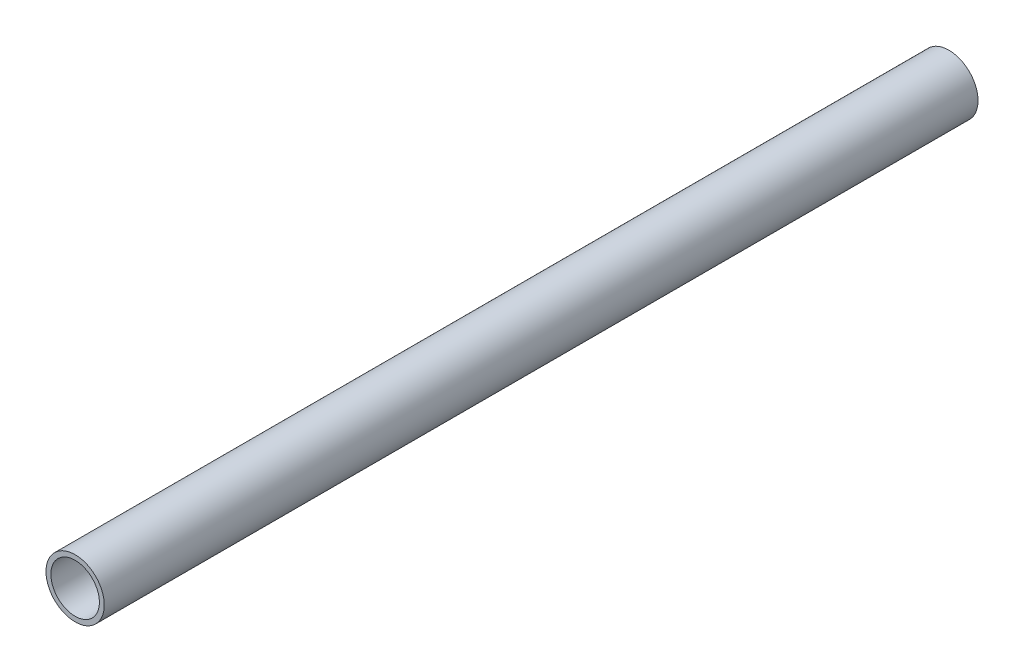
from build123d import *

# Parameters (mm, degrees)
CROQUIS1_R              = 6
CROQUIS1_R_2            = 5
SALIENTE_EXTRUIR1_DEPTH = 90


with BuildPart() as part:
    # Croquis1 → Saliente-Extruir1 (new, symmetric)
    with BuildSketch(Plane.XY):
        with Locations(Location((0, 0, 0), (0, 0, 180))):
            Circle(CROQUIS1_R)
        with Locations(Location((0, 0, 0), (0, 0, 180))):
            Circle(CROQUIS1_R_2, mode=Mode.SUBTRACT)
    extrude(amount=SALIENTE_EXTRUIR1_DEPTH, both=True)


solid = part.part
